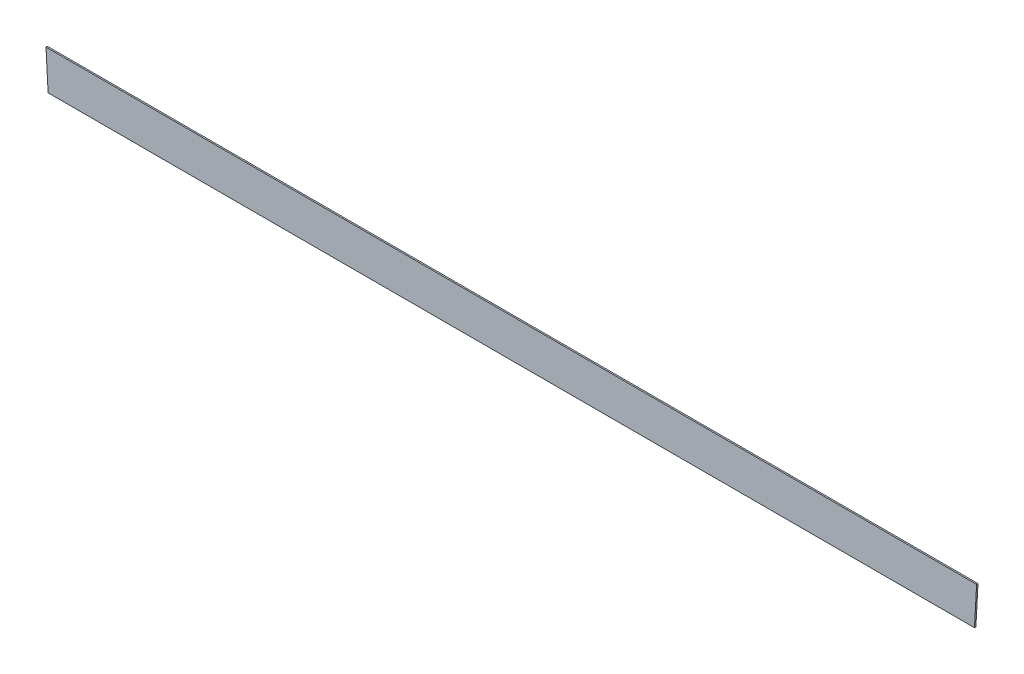
from build123d import *

# Parameters (mm, degrees)
BOSS_EXTRUDE1_DEPTH = 2


with BuildPart() as part:
    # Sketch1 → Boss-Extrude1 (new body)
    with BuildSketch(Plane.XY):
        Polygon((-660.5, 27.5), (-663.5, 27.5), (-660.5, -27.5), (660.5, -27.5), (663.5, 27.5), (660.5, 27.5), align=None)
    extrude(amount=BOSS_EXTRUDE1_DEPTH)


solid = part.part
